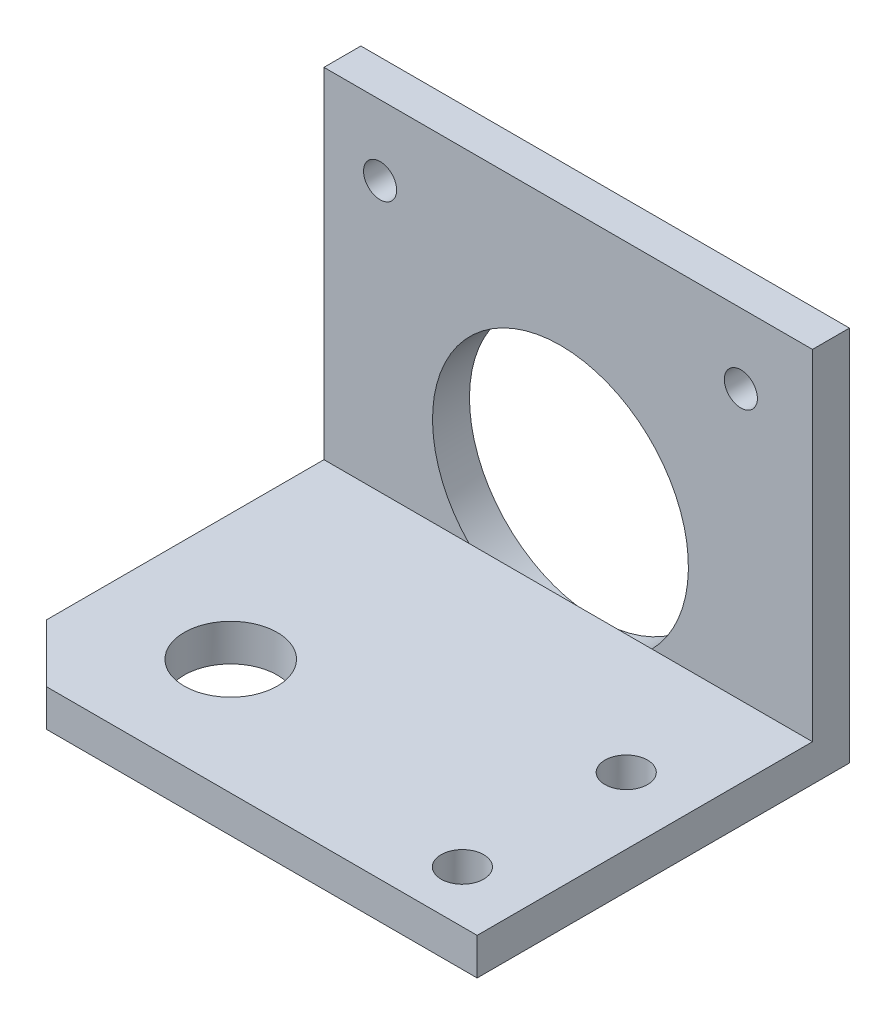
from build123d import *

# Parameters (mm, degrees)
SKETCH1_W           = 42
SKETCH1_H           = 32.004
BOSS_EXTRUDE1_DEPTH = 3.175
SKETCH2_W           = 42
SKETCH2_H           = 32.385
BOSS_EXTRUDE2_DEPTH = 3.175
SKETCH3_R           = 10.9982
SKETCH3_R_2         = 1.4224
CUT_EXTRUDE1_DEPTH  = 5.08
SKETCH4_R           = 4.0005
SKETCH4_R_2         = 1.8288
CUT_EXTRUDE2_DEPTH  = 5.1054
CUT_EXTRUDE3_DEPTH  = 40.373698125


with BuildPart() as part:
    # Sketch1 → Boss-Extrude1 (new body)
    with BuildSketch(Plane(origin=(0, 0, 0), x_dir=(1, 0, 0), z_dir=(0, 1, 0))):
        Rectangle(SKETCH1_W, SKETCH1_H)
    extrude(amount=BOSS_EXTRUDE1_DEPTH)

    # Sketch2 → Boss-Extrude2 (add)
    with BuildSketch(Plane(origin=(0, 0, -16.002), x_dir=(-1, 0, 0), z_dir=(0, 0, -1))):
        with Locations((0, 16.1925)):
            Rectangle(SKETCH2_W, SKETCH2_H)
    extrude(amount=-BOSS_EXTRUDE2_DEPTH)

    # Sketch3 → Cut-Extrude1 (cut)
    with BuildSketch(Plane.XY.offset(-12.827)):
        with Locations((-0.665996173, 10.8585)):
            Circle(SKETCH3_R)
        with Locations((-16.172696173, 26.3652)):
            Circle(SKETCH3_R_2)
        with Locations((14.840703827, 26.3652)):
            Circle(SKETCH3_R_2)
    extrude(amount=-CUT_EXTRUDE1_DEPTH, mode=Mode.SUBTRACT)

    # Sketch4 → Cut-Extrude2 (cut)
    with BuildSketch(Plane(origin=(0, 3.175, 0), x_dir=(1, 0, 0), z_dir=(0, 1, 0))):
        with Locations(Location((-10.14648729, -6.038137545, 0), (0, 0, 270))):
            Circle(SKETCH4_R)
        with Locations(Location((15.27051293, -11.541044372, 0), (0, 0, 270))):
            Circle(SKETCH4_R_2)
        with Locations(Location((15.27051293, 2.545639175, 0), (0, 0, 270))):
            Circle(SKETCH4_R_2)
    extrude(amount=-CUT_EXTRUDE2_DEPTH, mode=Mode.SUBTRACT)

    # Sketch5 → Cut-Extrude3 (cut, through all)
    with BuildSketch(Plane(origin=(0, 3.175, 0), x_dir=(1, 0, 0), z_dir=(0, 1, 0))):
        Polygon((-16.015261935, -16.002), (-21, -11.017261935), (-21, -16.002), align=None)
    extrude(amount=-CUT_EXTRUDE3_DEPTH, mode=Mode.SUBTRACT)


solid = part.part
